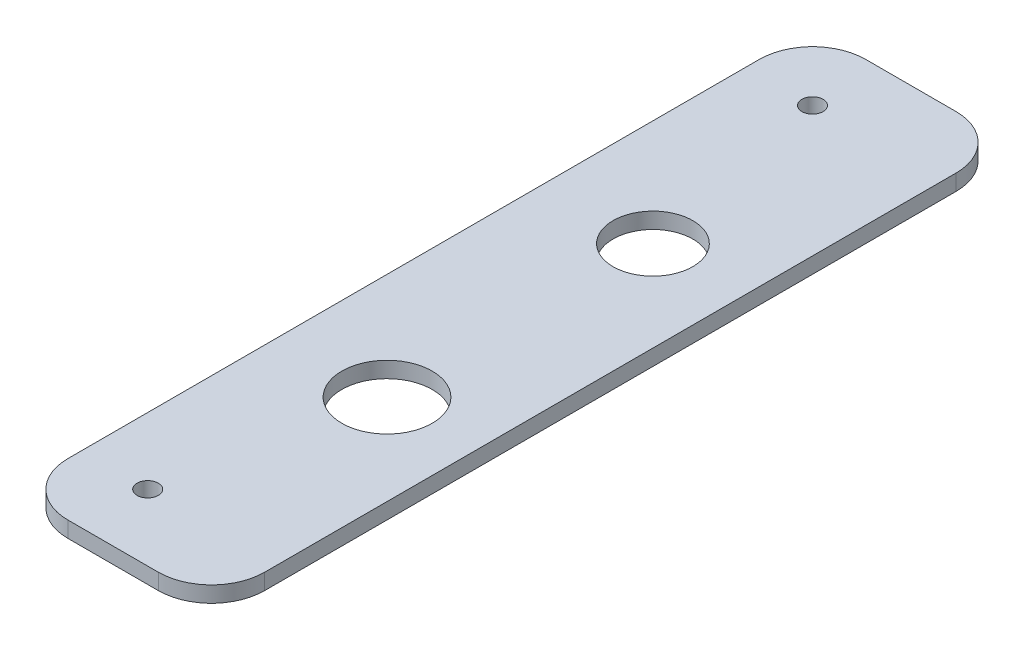
from build123d import *

# Parameters (mm, degrees)
CROQUIS1_W              = 37
CROQUIS1_H              = 150
CROQUIS1_R              = 7.5
CROQUIS1_R_2            = 8.5
SALIENTE_EXTRUIR1_DEPTH = 3
REDONDEO1_R             = 10
CROQUIS2_R              = 2
CORTAR_EXTRUIR1_DEPTH   = 10


with BuildPart() as part:
    # Croquis1 → Saliente-Extruir1 (new body)
    with BuildSketch(Plane(origin=(0, 0, 0), x_dir=(1, 0, 0), z_dir=(0, 1, 0))):
        Rectangle(CROQUIS1_W, CROQUIS1_H)
        with Locations(Location((1.5, 25, 0), (0, 0, 270))):
            Circle(CROQUIS1_R, mode=Mode.SUBTRACT)
        with Locations(Location((1.5, -25, 0), (0, 0, 270))):
            Circle(CROQUIS1_R_2, mode=Mode.SUBTRACT)
    extrude(amount=SALIENTE_EXTRUIR1_DEPTH)

    # Redondeo1
    redondeo1_edges = [part.edges().sort_by_distance(p)[0] for p in [
        (18.5, 1.5, 75),
        (-18.5, 1.5, 75),
        (-18.5, 1.5, -75),
        (18.5, 1.5, -75),
    ]]
    fillet(redondeo1_edges, radius=REDONDEO1_R)

    # Croquis2 → Cortar-Extruir1 (cut)
    with BuildSketch(Plane(origin=(0, 3, 0), x_dir=(1, 0, 0), z_dir=(0, 1, 0))):
        with Locations(Location((-6, 62.5, 0), (0, 0, 270))):
            Circle(CROQUIS2_R)
        with Locations(Location((-6, -62.5, 0), (0, 0, 270))):
            Circle(CROQUIS2_R)
    extrude(amount=-CORTAR_EXTRUIR1_DEPTH, mode=Mode.SUBTRACT)


solid = part.part
